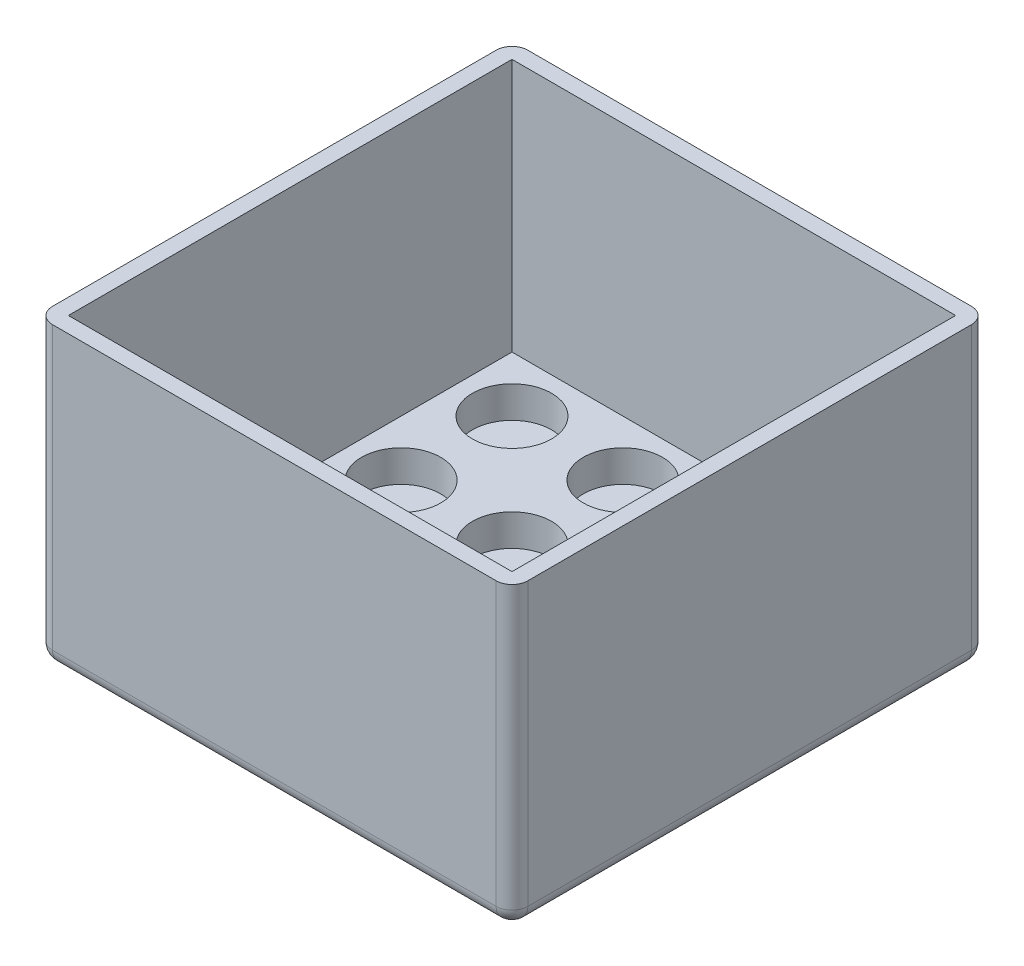
from build123d import *

# Parameters (mm, degrees)
SKETCH1_W           = 150
SKETCH1_H           = 150
SKETCH1_W_2         = 140
SKETCH1_H_2         = 140
BOSS_EXTRUDE1_DEPTH = 90
SKETCH2_W           = 150
SKETCH2_H           = 150
BOSS_EXTRUDE2_DEPTH = 4
SKETCH3_W           = 140
SKETCH3_H           = 140
SKETCH3_R           = 12.5
BOSS_EXTRUDE3_DEPTH = 10
FILLET1_R           = 5


with BuildPart() as part:
    # Sketch1 → Boss-Extrude1 (new body)
    with BuildSketch(Plane(origin=(0, 0, 0), x_dir=(1, 0, 0), z_dir=(0, 1, 0))):
        with Locations((70, 70)):
            Rectangle(SKETCH1_W, SKETCH1_H)
        with Locations((70, 70)):
            Rectangle(SKETCH1_W_2, SKETCH1_H_2, mode=Mode.SUBTRACT)
    extrude(amount=BOSS_EXTRUDE1_DEPTH)

    # Sketch2 → Boss-Extrude2 (add)
    with BuildSketch(Plane.XZ):
        with Locations((70, -70)):
            Rectangle(SKETCH2_W, SKETCH2_H)
    extrude(amount=BOSS_EXTRUDE2_DEPTH)

    # Sketch3 → Boss-Extrude3 (add)
    with BuildSketch(Plane(origin=(0, 0, 0), x_dir=(1, 0, 0), z_dir=(0, 1, 0))):
        with Locations((70, 70)):
            Rectangle(SKETCH3_W, SKETCH3_H)
        with Locations(Location((17.5, 17.5, 0), (0, 0, 270))):
            Circle(SKETCH3_R, mode=Mode.SUBTRACT)
        with Locations(Location((17.5, 52.5, 0), (0, 0, 270))):
            Circle(SKETCH3_R, mode=Mode.SUBTRACT)
        with Locations(Location((17.5, 87.5, 0), (0, 0, 270))):
            Circle(SKETCH3_R, mode=Mode.SUBTRACT)
        with Locations(Location((122.5, 17.5, 0), (0, 0, 270))):
            Circle(SKETCH3_R, mode=Mode.SUBTRACT)
        with Locations(Location((87.5, 17.5, 0), (0, 0, 270))):
            Circle(SKETCH3_R, mode=Mode.SUBTRACT)
        with Locations(Location((52.5, 17.5, 0), (0, 0, 270))):
            Circle(SKETCH3_R, mode=Mode.SUBTRACT)
        with Locations(Location((122.5, 52.5, 0), (0, 0, 270))):
            Circle(SKETCH3_R, mode=Mode.SUBTRACT)
        with Locations(Location((87.5, 52.5, 0), (0, 0, 270))):
            Circle(SKETCH3_R, mode=Mode.SUBTRACT)
        with Locations(Location((52.5, 52.5, 0), (0, 0, 270))):
            Circle(SKETCH3_R, mode=Mode.SUBTRACT)
        with Locations(Location((122.5, 87.5, 0), (0, 0, 270))):
            Circle(SKETCH3_R, mode=Mode.SUBTRACT)
        with Locations(Location((87.5, 87.5, 0), (0, 0, 270))):
            Circle(SKETCH3_R, mode=Mode.SUBTRACT)
        with Locations(Location((52.5, 87.5, 0), (0, 0, 270))):
            Circle(SKETCH3_R, mode=Mode.SUBTRACT)
        with Locations(Location((122.5, 122.5, 0), (0, 0, 270))):
            Circle(SKETCH3_R, mode=Mode.SUBTRACT)
        with Locations(Location((87.5, 122.5, 0), (0, 0, 270))):
            Circle(SKETCH3_R, mode=Mode.SUBTRACT)
        with Locations(Location((52.5, 122.5, 0), (0, 0, 270))):
            Circle(SKETCH3_R, mode=Mode.SUBTRACT)
        with Locations(Location((17.5, 122.5, 0), (0, 0, 270))):
            Circle(SKETCH3_R, mode=Mode.SUBTRACT)
    extrude(amount=BOSS_EXTRUDE3_DEPTH)

    # Fillet1
    fillet1_edges = [part.edges().sort_by_distance(p)[0] for p in [
        (145, -4, -70),
        (70, -4, 5),
        (-5, -4, -70),
        (70, -4, -145),
        (-5, 43, -145),
        (145, 43, -145),
        (145, 43, 5),
        (-5, 43, 5),
    ]]
    fillet(fillet1_edges, radius=FILLET1_R)


solid = part.part
